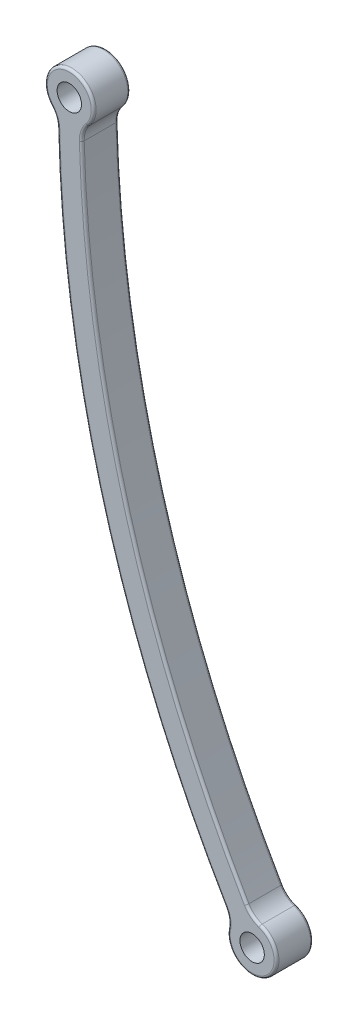
from build123d import *

# Parameters (mm, degrees)
SKETCH1_R           = 1.27
BOSS_EXTRUDE1_DEPTH = 1.905
FILLET1_R           = 2.54
FILLET2_R           = 0.254
SCALE1_SCALE        = 1.5


with BuildPart() as part:
    # Sketch1 → Boss-Extrude1 (new, symmetric)
    with BuildSketch(Plane.XY):
        with BuildLine():
            ThreePointArc((-17.78, 65.002378775), (-19.05, 69.742083301), (-20.32, 65.002378775))
            ThreePointArc((-20.32, 65.002378775), (-15.489369755, 31.933659243), (-2.199704526, 1.27))
            ThreePointArc((-2.199704526, 1.27), (1.27, -2.199704526), (0, 2.54))
            ThreePointArc((0, 2.54), (-12.950130529, 32.61546778), (-17.78, 65.002378775))
        make_face()
        with Locations(Location((-19.05, 67.202083301, 0), (0, 0, 180))):
            Circle(SKETCH1_R, mode=Mode.SUBTRACT)
        with Locations(Location((0, 0, 0), (0, 0, 180))):
            Circle(SKETCH1_R, mode=Mode.SUBTRACT)
    extrude(amount=BOSS_EXTRUDE1_DEPTH, both=True)

    # Fillet1
    fillet1_edges = [part.edges().sort_by_distance(p)[0] for p in [
        (0, 2.54, 0),
        (-2.199704526, 1.27, 0),
        (-20.32, 65.002378775, 0),
        (-17.78, 65.002378775, 0),
    ]]
    fillet(fillet1_edges, radius=FILLET1_R)

    # Fillet2
    fillet2_edges = [part.edges().sort_by_distance(p)[0] for p in [
        (-12.944837831, 32.596879535, -1.905),
        (-12.944837831, 32.596879535, 1.905),
        (1.277759543, -2.195206266, -1.905),
        (1.277759543, -2.195206266, 1.905),
        (-15.494383054, 31.951296771, -1.905),
        (-15.494383054, 31.951296771, 1.905),
        (-19.068010515, 69.742019446, -1.905),
        (-19.068010515, 69.742019446, 1.905),
        (0.003745513, 2.848900008, -1.905),
        (0.003745513, 2.848900008, 1.905),
        (-2.479958878, 1.409004676, -1.905),
        (-2.479958878, 1.409004676, 1.905),
        (-20.47647458, 64.750228521, -1.905),
        (-20.47647458, 64.750228521, 1.905),
        (-17.604676807, 64.727772481, -1.905),
        (-17.604676807, 64.727772481, 1.905),
    ]]
    fillet(fillet2_edges, radius=FILLET2_R)


with BuildPart() as part_1:
    # Scale1: scaled about (-12.359782822, 32.802390244, 0)
    add(part.part.scale(SCALE1_SCALE).moved(Location((6.179891411, -16.401195122, 0))))


solid = part_1.part
